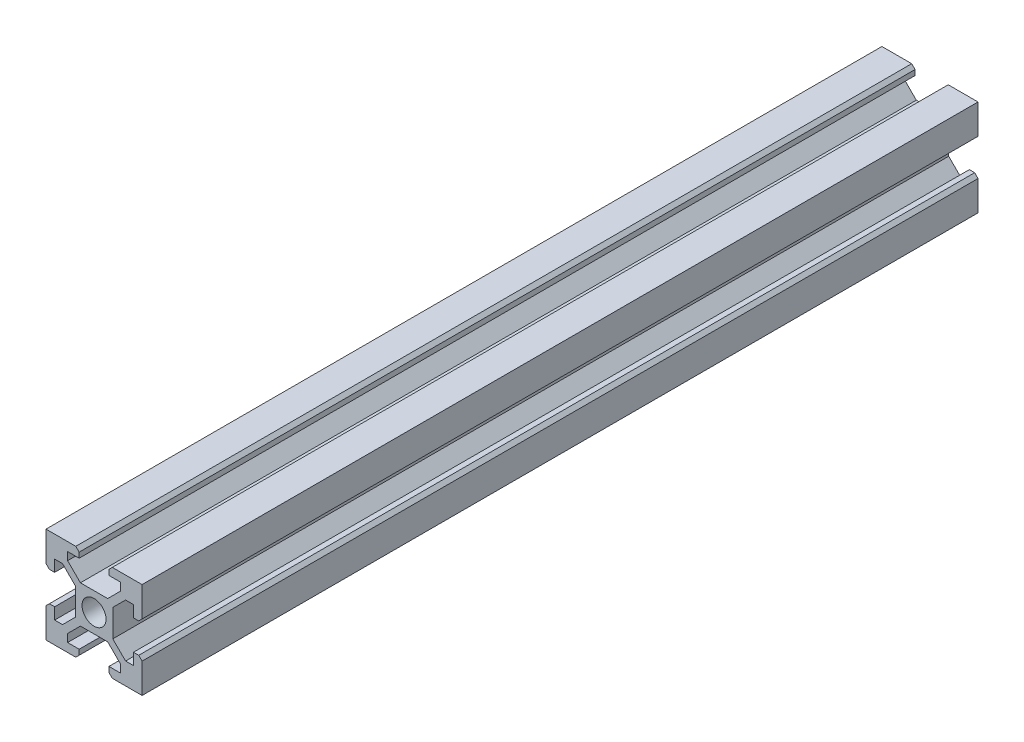
from build123d import *

# Parameters (mm, degrees)
SKETCH1_R           = 2.5
BOSS_EXTRUDE1_DEPTH = 87


with BuildPart() as part:
    # Sketch1 → Boss-Extrude1 (new, symmetric)
    with BuildSketch(Plane.XY):
        Polygon((3.9, -2.839339828), (6.560660172, -5.5), (8.200660172, -5.5), (8.200660172, -3.1), (9.3, -3.1), (10, -3.8), (10, -10), (3.8, -10), (3.1, -9.3), (3.1, -8.200660172), (5.5, -8.200660172), (5.5, -6.560660172), (2.839339828, -3.9), (-2.839339828, -3.9), (-5.5, -6.560660172), (-5.5, -8.200660172), (-3.1, -8.200660172), (-3.1, -9.3), (-3.8, -10), (-10, -10), (-10, -3.8), (-9.3, -3.1), (-8.200660172, -3.1), (-8.200660172, -5.5), (-6.560660172, -5.5), (-3.9, -2.839339828), (-3.9, 2.839339828), (-6.560660172, 5.5), (-8.200660172, 5.5), (-8.200660172, 3.1), (-9.3, 3.1), (-10, 3.8), (-10, 10), (-3.8, 10), (-3.1, 9.3), (-3.1, 8.200660172), (-5.5, 8.200660172), (-5.5, 6.560660172), (-2.839339828, 3.9), (2.839339828, 3.9), (5.5, 6.560660172), (5.5, 8.200660172), (3.1, 8.200660172), (3.1, 9.3), (3.8, 10), (10, 10), (10, 3.8), (9.3, 3.1), (8.200660172, 3.1), (8.200660172, 5.5), (6.560660172, 5.5), (3.9, 2.839339828), align=None)
        Circle(SKETCH1_R, mode=Mode.SUBTRACT)
    extrude(amount=BOSS_EXTRUDE1_DEPTH, both=True)


solid = part.part
